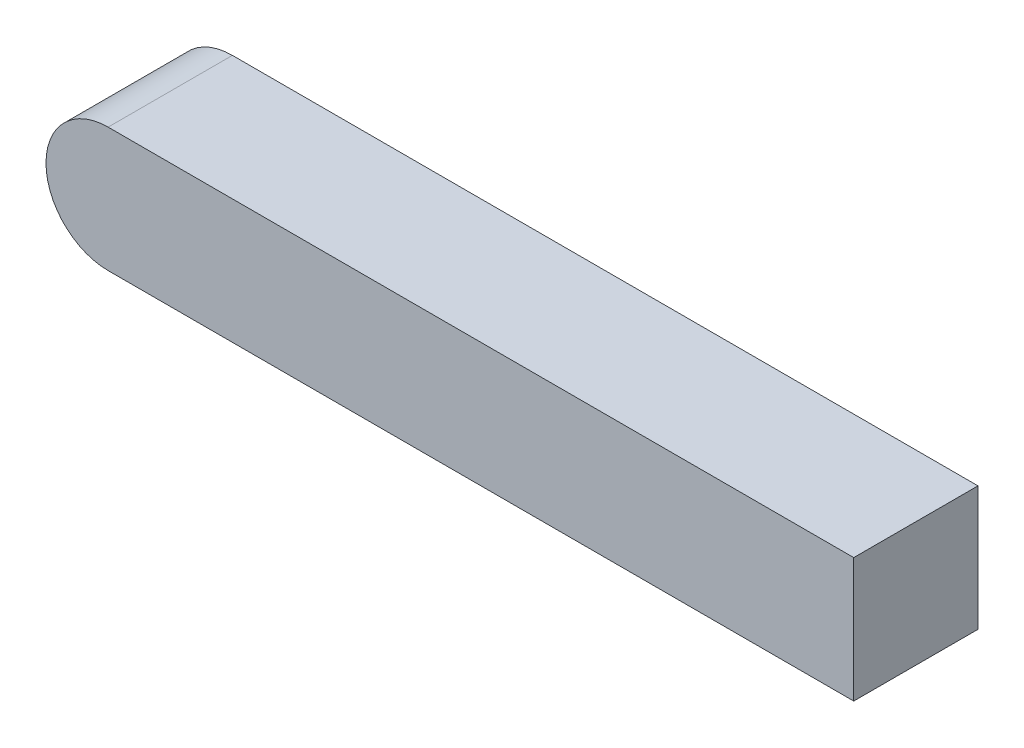
from build123d import *

# Parameters (mm, degrees)
BOSS_EXTRUDE1_DEPTH = 8


with BuildPart() as part:
    # Sketch1 → Boss-Extrude1 (new body)
    with BuildSketch(Plane.XY):
        with BuildLine():
            Line((48, -4), (48, 4))
            Line((48, 4), (0, 4))
            ThreePointArc((0, 4), (-4, 0), (0, -4))
            Line((0, -4), (48, -4))
        make_face()
    extrude(amount=BOSS_EXTRUDE1_DEPTH)


solid = part.part
